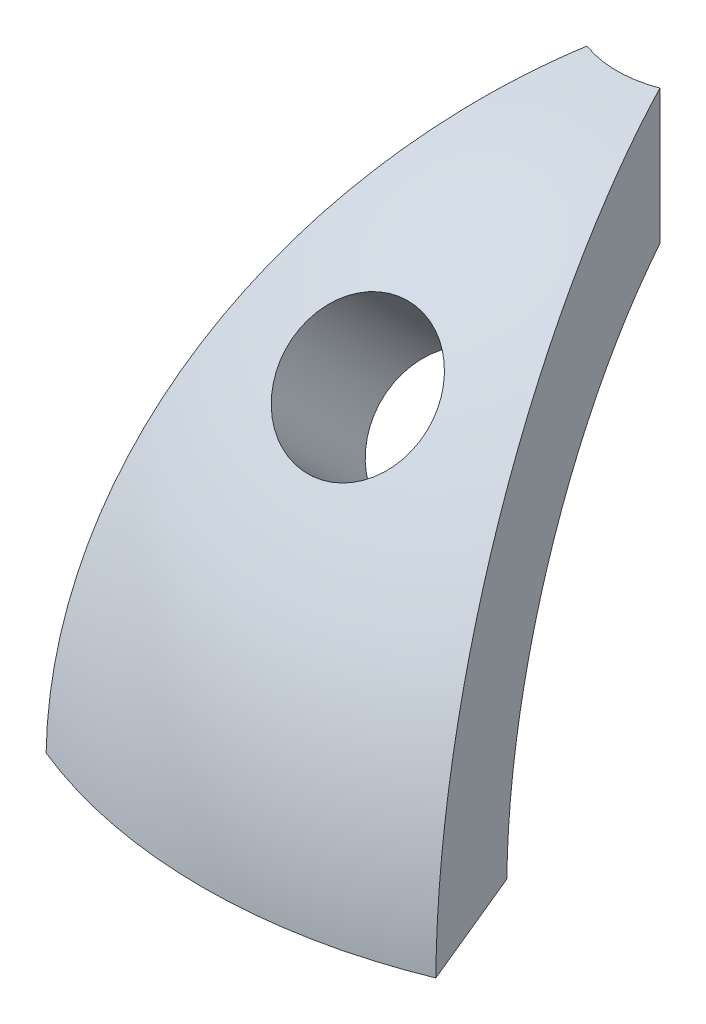
from build123d import *

# Parameters (mm, degrees)
REVOLVE1_ANGLE            = 45
CUT_EXTRUDE1_DEPTH        = 28.647117169
CUT_EXTRUDE1_DEPTH_BACK   = 28.647117169
CUT_EXTRUDE4_REACH        = 29.998
CUT_EXTRUDE4_START_RADIUS = 14.22
CUT_EXTRUDE4_END_RADIUS   = 14.22
CUT_EXTRUDE5_DEPTH        = 26.131771039
CUT_EXTRUDE5_DEPTH_BACK   = 26.131771039
SKETCH9_R                 = 2.6035


with BuildPart() as part:
    # Sketch1 → Revolve1 (revolve, symmetric)
    with BuildSketch(Plane(origin=(0, 0, 0), x_dir=(0, 0, -1), z_dir=(1, 0, 0))) as revolve1_sk:
        with BuildLine():
            Line((-14.217802221, 0.25), (-19.048359509, 0.25))
            ThreePointArc((-19.048359509, 0.25), (-14.676690222, 12.144845166), (-3.81, 18.66511184))
            Line((-3.81, 18.66511184), (-3.81, 13.700083941))
            ThreePointArc((-3.81, 13.700083941), (-11.246181696, 8.70240181), (-14.217802221, 0.25))
        make_face()
    revolve(axis=Axis((0, 0, 0), (0, 1, 0)), revolution_arc=REVOLVE1_ANGLE / 2)
    revolve(revolve1_sk.sketch, axis=Axis((0, 0, 0), (0, -1, 0)), revolution_arc=REVOLVE1_ANGLE / 2)

    # Sketch2 → Cut-Extrude1 (cut, two sides: drawn at the far end of the back side and taken through both)
    with BuildSketch(Plane(origin=(0, 0, 0), x_dir=(1, 0, 0), z_dir=(0, 1, 0)).offset(-CUT_EXTRUDE1_DEPTH_BACK)):
        with BuildLine():
            Line((7.289491598, -17.598389479), (1.458023877, -3.519981019))
            ThreePointArc((1.458023877, -3.519981019), (1.400077392, -3.543428184), (1.341754023, -3.5659215))
            Line((1.341754023, -3.5659215), (7.173849701, -17.645845983))
            ThreePointArc((7.173849701, -17.645845983), (7.231709577, -17.622212591), (7.289491598, -17.598389479))
        make_face()
        with BuildLine():
            Line((-7.173849701, -17.645845983), (-1.341754023, -3.5659215))
            ThreePointArc((-1.341754023, -3.5659215), (-1.400077392, -3.543428184), (-1.458023877, -3.519981019))
            Line((-1.458023877, -3.519981019), (-7.289491598, -17.598389479))
            ThreePointArc((-7.289491598, -17.598389479), (-7.231709577, -17.622212591), (-7.173849701, -17.645845983))
        make_face()
    extrude(amount=CUT_EXTRUDE1_DEPTH + CUT_EXTRUDE1_DEPTH_BACK, mode=Mode.SUBTRACT)

    # Cut-Extrude4: from a sphere face, 29.998 long prism both ways, kept between that surface and its translate by the depth
    cut_extrude4_start = Location((0, 0, 0)) * Sphere(CUT_EXTRUDE4_START_RADIUS, mode=Mode.PRIVATE)
    cut_extrude4_end = Location((0, 0.145802388, 0.351998102)) * Sphere(CUT_EXTRUDE4_END_RADIUS, mode=Mode.PRIVATE)
    # Sketch8 → Cut-Extrude4 (cut, from a surface)
    with BuildSketch(Plane(origin=(0, 0, 0), x_dir=(-1, 0, 0), z_dir=(0, 0.3826834323650899, 0.9238795325112868)), mode=Mode.PRIVATE) as cut_extrude4_sk1:
        Polygon((-0.593913261, -0.505052528), (0.227948718, -0.505052528), (0.227948718, 3.939947472), (-0.170961538, 3.939947472), (-0.170961538, -0.049155093), (-0.854807692, -0.049155093), align=None)
    cut_extrude4_tool1 = extrude(cut_extrude4_sk1.sketch, amount=CUT_EXTRUDE4_REACH, both=True, mode=Mode.PRIVATE)
    add(((cut_extrude4_tool1 - cut_extrude4_start) & cut_extrude4_end).solids().sort_by_distance((0.031455, 4.048316, 13.618019))[0], mode=Mode.SUBTRACT)

    # Sketch9 → Cut-Extrude5 (cut, two sides: drawn at the far end of the back side and taken through both)
    with BuildSketch(Plane(origin=(0, 18.858537854, 18.858537854), x_dir=(1, 0, 0), z_dir=(0, 0.7071067811865478, 0.7071067811865474)).offset(-CUT_EXTRUDE5_DEPTH_BACK)):
        with Locations(Location((0, 0, 0), (0, 0, 90))):
            Circle(SKETCH9_R)
    extrude(amount=CUT_EXTRUDE5_DEPTH + CUT_EXTRUDE5_DEPTH_BACK, mode=Mode.SUBTRACT)


solid = part.part
